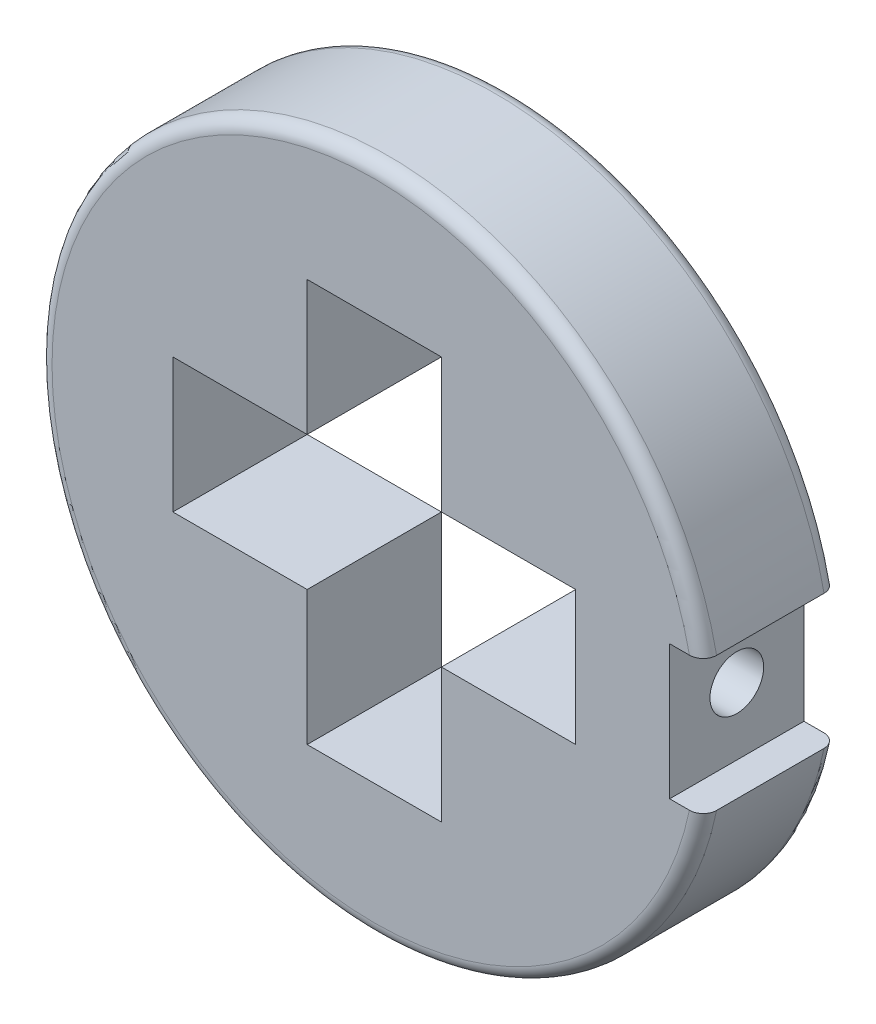
from build123d import *

# Parameters (mm, degrees)
SKETCH1_R               = 25
BOSS_EXTRUDE1_DEPTH     = 10
CUT_EXTRUDE1_DEPTH      = 37.742346142
CUT_EXTRUDE1_DEPTH_BACK = 37.742346142
CUT_EXTRUDE2_DEPTH      = 3
SKETCH5_R               = 2
CUT_EXTRUDE4_DEPTH      = 13
FILLET1_R               = 1
CUT_EXTRUDE6_DEPTH      = 3
CUT_EXTRUDE6_DEPTH_BACK = 3
SKETCH6_W               = 10
SKETCH6_H               = 10


with BuildPart() as part:
    # Sketch1 → Boss-Extrude1 (new body)
    with BuildSketch(Plane.XY):
        Circle(SKETCH1_R)
    extrude(amount=BOSS_EXTRUDE1_DEPTH)

    # Sketch2 → Cut-Extrude1 (cut, two sides: drawn at the far end of the back side and taken through both)
    with BuildSketch(Plane.XY.offset(10).offset(-CUT_EXTRUDE1_DEPTH_BACK)):
        Polygon((5, -5), (15, -5), (15, 5), (5, 5), (5, 15), (-5, 15), (-5, 5), (-15, 5), (-15, -5), (-5, -5), (-5, -15), (5, -15), align=None)
    extrude(amount=CUT_EXTRUDE1_DEPTH + CUT_EXTRUDE1_DEPTH_BACK, mode=Mode.SUBTRACT)

    # Sketch4 → Cut-Extrude2 (cut)
    with BuildSketch(Plane.ZY.offset(-15)):
        Polygon((4.759098318, -4.265594884), (8.57366269, -2.341424419), (8.814564373, 1.924170465), (5.240901682, 4.265594884), (1.42633731, 2.341424419), (1.185435627, -1.924170465), align=None)
    extrude(amount=-CUT_EXTRUDE2_DEPTH, mode=Mode.SUBTRACT)

    # Sketch5 → Cut-Extrude4 (cut)
    with BuildSketch(Plane.ZY.offset(-18)):
        with Locations((5, 0)):
            Circle(SKETCH5_R)
    extrude(amount=-CUT_EXTRUDE4_DEPTH, mode=Mode.SUBTRACT)

    # Fillet1
    fillet1_edges = [part.edges().sort_by_distance(p)[0] for p in [
        (-25, 0, 0),
        (-25, 0, 10),
    ]]
    fillet(fillet1_edges, radius=FILLET1_R)

    # Sketch6 → Cut-Extrude6 (cut, two sides: drawn at the far end of the back side and taken through both)
    with BuildSketch(Plane.YZ.offset(24.999151456).offset(-CUT_EXTRUDE6_DEPTH_BACK)):
        with Locations((0, 5)):
            Rectangle(SKETCH6_W, SKETCH6_H)
    extrude(amount=CUT_EXTRUDE6_DEPTH + CUT_EXTRUDE6_DEPTH_BACK, mode=Mode.SUBTRACT)


solid = part.part
